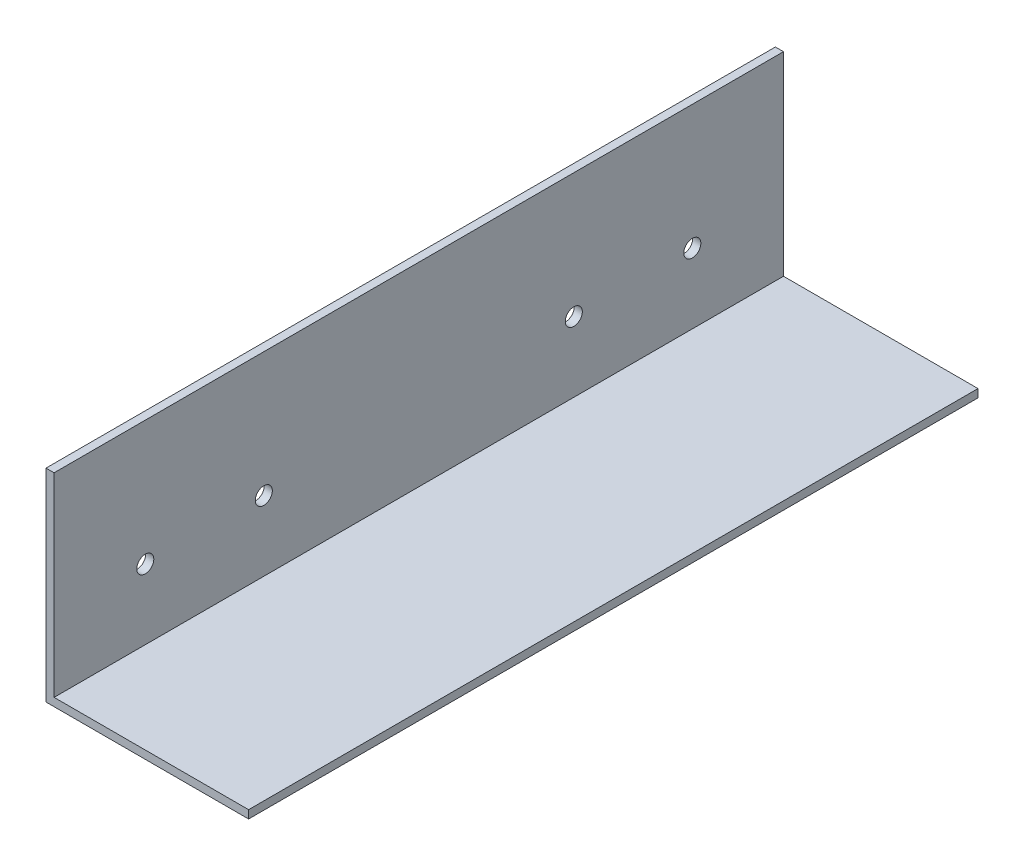
from build123d import *

# Parameters (mm, degrees)
BOSS_EXTRUDE1_DEPTH = 180
SKETCH2_R           = 2.1
CUT_EXTRUDE1_DEPTH  = 5


with BuildPart() as part:
    # Sketch1 → Boss-Extrude1 (new body)
    with BuildSketch(Plane.XY):
        Polygon((0, 0), (50, 0), (50, 2), (2, 2), (2, 50), (0, 50), align=None)
    extrude(amount=BOSS_EXTRUDE1_DEPTH)

    # Sketch2 → Cut-Extrude1 (cut, symmetric)
    with BuildSketch(Plane(origin=(0, 0, 0), x_dir=(0, 0, -1), z_dir=(1, 0, 0))):
        with Locations((-22.5, 19.25)):
            Circle(SKETCH2_R)
        with Locations((-51.75, 19.25)):
            Circle(SKETCH2_R)
        with Locations((-128.25, 19.25)):
            Circle(SKETCH2_R)
        with Locations((-157.5, 19.25)):
            Circle(SKETCH2_R)
    extrude(amount=CUT_EXTRUDE1_DEPTH, both=True, mode=Mode.SUBTRACT)


solid = part.part
